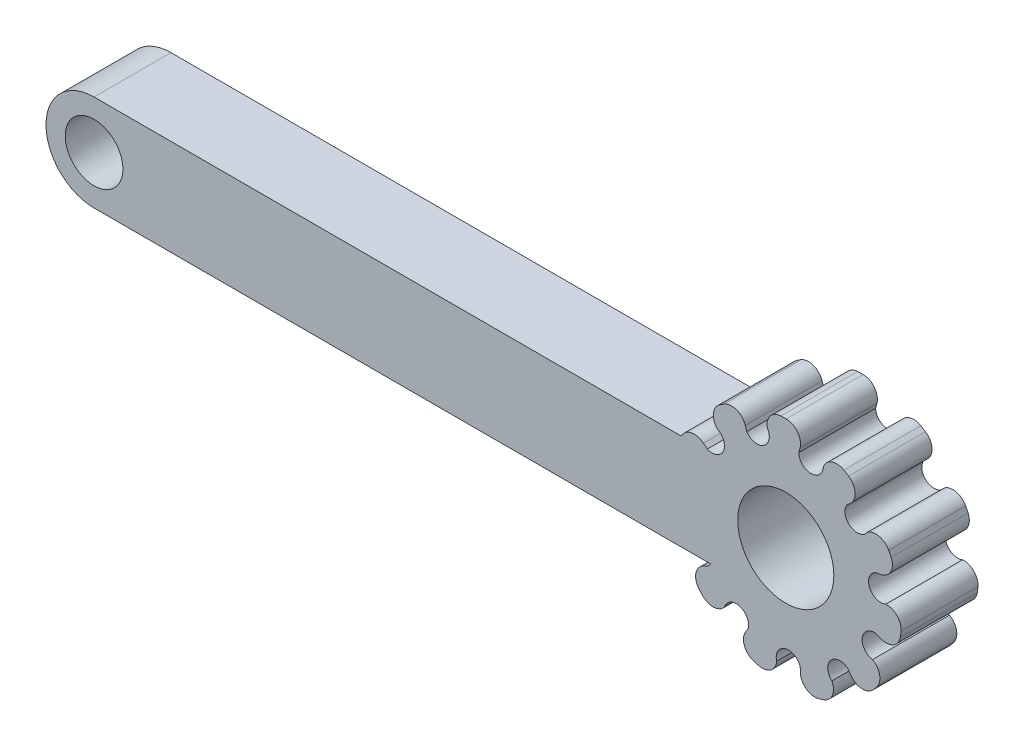
from build123d import *

# Parameters (mm, degrees)
SKETCH1_R           = 1.5
BOSS_EXTRUDE1_DEPTH = 4
CUT_EXTRUDE1_START  = -4
CUT_EXTRUDE1_DEPTH  = 4
CIRPATTERN2_COUNT   = 11
SKETCH3_W           = 6.093608585
SKETCH3_H           = 4.996234569
BOSS_EXTRUDE2_DEPTH = 4
SKETCH4_R           = 2.5
CUT_EXTRUDE2_DEPTH  = 4


with BuildPart() as part:
    # Sketch1 → Boss-Extrude1 (new body)
    with BuildSketch(Plane.XY):
        with BuildLine():
            Line((-18, 2.5), (12.545643943, 2.5))
            ThreePointArc((12.545643943, 2.5), (24, 0), (12.545643943, -2.5))
            Line((12.545643943, -2.5), (-18, -2.5))
            ThreePointArc((-18, -2.5), (-20.5, 0), (-18, 2.5))
        make_face()
        with Locations((-18, 0)):
            Circle(SKETCH1_R, mode=Mode.SUBTRACT)
    extrude(amount=BOSS_EXTRUDE1_DEPTH)

    # Sketch2 → Cut-Extrude1 (cut)
    with BuildSketch(Plane.XY.offset(4).offset(CUT_EXTRUDE1_START)):
        with BuildLine():
            Line((18.72, 5.06), (18.653012702, 4.81))
            ThreePointArc((18.653012702, 4.81), (19.291515108, 4.181419291), (19.930017513, 4.81))
            ThreePointArc((19.930017513, 4.81), (19.930088137, 4.81213776), (19.930232945, 4.814271778))
            ThreePointArc((19.930232945, 4.814271778), (20.377650935, 5.25023041), (21, 5.196152423))
            ThreePointArc((21, 5.196152423), (19.552914271, 5.795554958), (18, 6))
            ThreePointArc((18, 6), (18.589879661, 5.706078038), (18.72, 5.06))
        make_face()
    cut_extrude1 = extrude(amount=CUT_EXTRUDE1_DEPTH, mode=Mode.SUBTRACT)

    # CirPattern2: Cut-Extrude1 ×11 about axis
    cirpattern2_axis = Axis((18, 0, 0), (0, 0, 1))
    for i in range(1, CIRPATTERN2_COUNT):
        add(cut_extrude1.rotate(cirpattern2_axis, i * 360 / CIRPATTERN2_COUNT), mode=Mode.SUBTRACT)

    # Sketch3 → Boss-Extrude2 (add)
    with BuildSketch(Plane.XY.offset(4)):
        with Locations((12.072309907, 0.001882715)):
            Rectangle(SKETCH3_W, SKETCH3_H)
    extrude(amount=-BOSS_EXTRUDE2_DEPTH)

    # Sketch4 → Cut-Extrude2 (cut)
    with BuildSketch(Plane.XY.offset(4)):
        with Locations((17.976309792, 0.185764476)):
            Circle(SKETCH4_R)
    extrude(amount=-CUT_EXTRUDE2_DEPTH, mode=Mode.SUBTRACT)


solid = part.part
